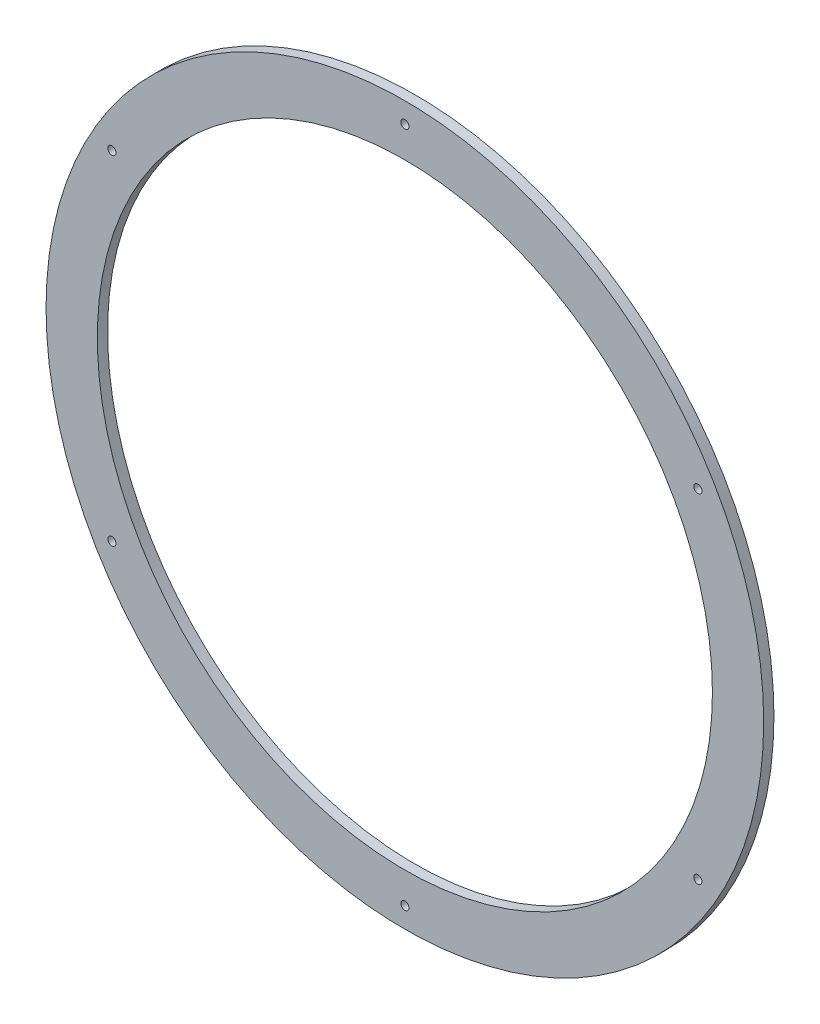
from build123d import *

# Parameters (mm, degrees)
ESQUISSE1_R             = 175
ESQUISSE1_R_2           = 150
BOSS_EXTRU_1_DEPTH      = 5
ESQUISSE2_R             = 2
ENL_V_MAT_EXTRU_1_DEPTH = 10


with BuildPart() as part:
    # Esquisse1 → Boss.-Extru.1 (new body)
    with BuildSketch(Plane.XY):
        Circle(ESQUISSE1_R)
        Circle(ESQUISSE1_R_2, mode=Mode.SUBTRACT)
    extrude(amount=BOSS_EXTRU_1_DEPTH)

    # Esquisse2 → Enlèv. mat.-Extru.1 (cut)
    with BuildSketch(Plane.XY.offset(5)):
        with Locations((0, 165)):
            Circle(ESQUISSE2_R)
        with Locations((142.894191624, 82.5)):
            Circle(ESQUISSE2_R)
        with Locations((142.894191624, -82.5)):
            Circle(ESQUISSE2_R)
        with Locations((0, -165)):
            Circle(ESQUISSE2_R)
        with Locations((-142.894191624, -82.5)):
            Circle(ESQUISSE2_R)
        with Locations((-142.894191624, 82.5)):
            Circle(ESQUISSE2_R)
    extrude(amount=-ENL_V_MAT_EXTRU_1_DEPTH, mode=Mode.SUBTRACT)


solid = part.part
